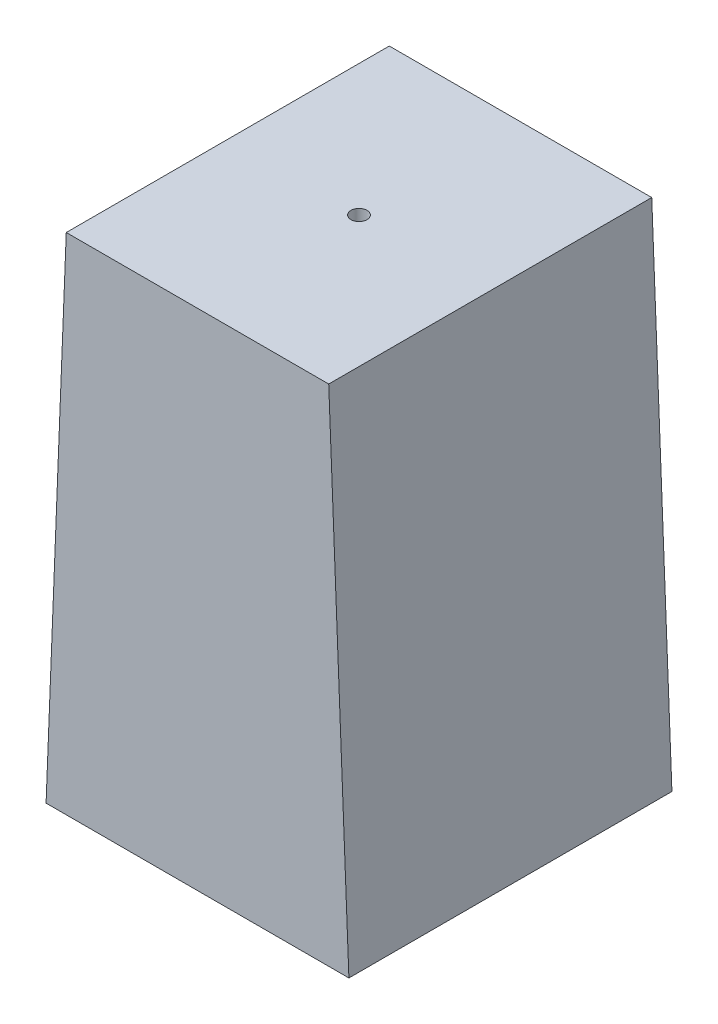
from build123d import *

# Parameters (mm, degrees)
BOSS_EXTRUDE1_DEPTH = 16
SKETCH4_R           = 0.4
CUT_EXTRUDE1_DEPTH  = 32


with BuildPart() as part:
    # Sketch1 → Boss-Extrude1 (new body)
    with BuildSketch(Plane.XY):
        Polygon((0, 0), (15, 0), (14, 24.979991994), (1, 24.979991994), align=None)
    extrude(amount=BOSS_EXTRUDE1_DEPTH)

    # Sketch4 → Cut-Extrude1 (cut)
    with BuildSketch(Plane(origin=(0, 24.979991994, 0), x_dir=(1, 0, 0), z_dir=(0, 1, 0))):
        with Locations(Location((7.5, -8, 0), (0, 0, 270))):
            Circle(SKETCH4_R)
    extrude(amount=-CUT_EXTRUDE1_DEPTH, mode=Mode.SUBTRACT)


solid = part.part
